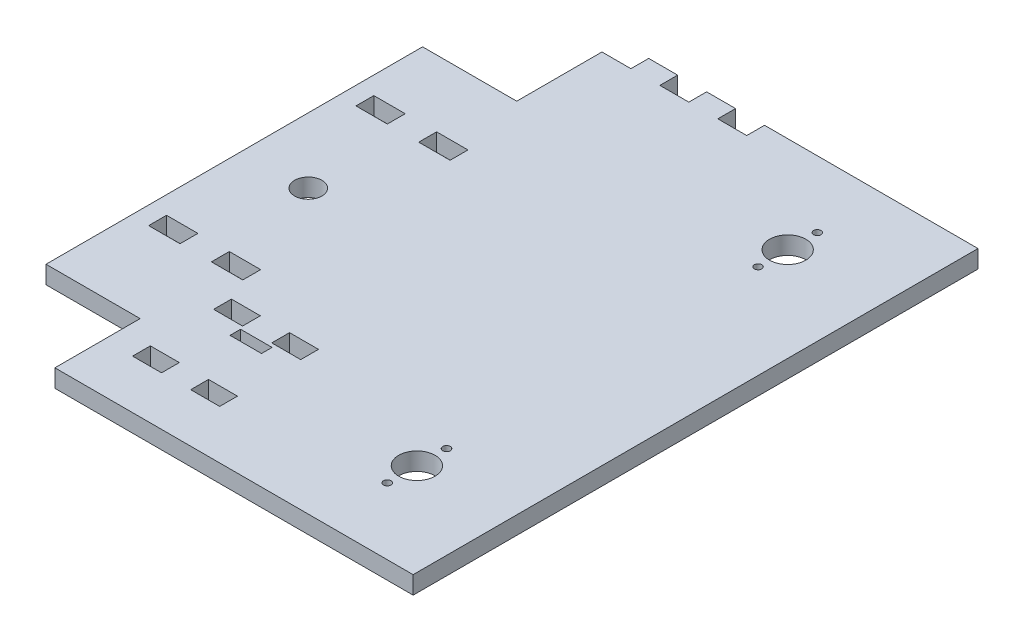
from build123d import *

# Parameters (mm, degrees)
SKETCH1_W           = 96.655493252
SKETCH1_H           = 152.4
BOSS_EXTRUDE1_DEPTH = 4.800000052
SKETCH3_W           = 7.8117192
SKETCH3_H           = 4.800000052
CUT_EXTRUDE2_DEPTH  = 181.530009628
SKETCH5_W           = 8.5
SKETCH5_H           = 2.852224977
CUT_EXTRUDE3_DEPTH  = 181.530009628
SKETCH6_W           = 101.6
SKETCH6_H           = 4.800000052
BOSS_EXTRUDE2_DEPTH = 25.4
SKETCH7_R           = 3.683
CUT_EXTRUDE4_DEPTH  = 181.530009628
SKETCH8_W           = 8.466666666
SKETCH8_H           = 4.826
SKETCH8_W_2         = 8.466666667
CUT_EXTRUDE5_DEPTH  = 181.530009628
SKETCH9_R           = 1.00000054
SKETCH9_R_2         = 1
SKETCH9_R_3         = 1.016
SKETCH9_R_4         = 4.899999979
CUT_EXTRUDE6_DEPTH  = 181.530009628


with BuildPart() as part:
    # Sketch1 → Boss-Extrude1 (new body)
    with BuildSketch(Plane(origin=(0, 0, 0), x_dir=(1, 0, 0), z_dir=(0, 1, 0))):
        with Locations((48.327746626, 76.2)):
            Rectangle(SKETCH1_W, SKETCH1_H)
    extrude(amount=BOSS_EXTRUDE1_DEPTH)

    # Sketch3 → Cut-Extrude2 (cut, through all)
    with BuildSketch(Plane.XZ):
        with Locations((3.9058596, -149.999999974)):
            Rectangle(SKETCH3_W, SKETCH3_H)
        with Locations((19.529298, -149.999999974)):
            Rectangle(SKETCH3_W, SKETCH3_H)
        with Locations((35.1527364, -149.999999974)):
            Rectangle(SKETCH3_W, SKETCH3_H)
        with Locations((27.3410172, -37.473737167)):
            Rectangle(SKETCH3_W, SKETCH3_H)
        with Locations((11.655298, -37.473737167)):
            Rectangle(SKETCH3_W, SKETCH3_H)
        with Locations((11.655298, -15.608000026)):
            Rectangle(SKETCH3_W, SKETCH3_H)
        with Locations((27.3410172, -15.608000026)):
            Rectangle(SKETCH3_W, SKETCH3_H)
    extrude(amount=-CUT_EXTRUDE2_DEPTH, mode=Mode.SUBTRACT)

    # Sketch5 → Cut-Extrude3 (cut, through all)
    with BuildSketch(Plane(origin=(0, 0, 0), x_dir=(-1, 0, 0), z_dir=(0, -1, 0))):
        with Locations((-20.288559041, 32.636660711)):
            Rectangle(SKETCH5_W, SKETCH5_H)
    extrude(amount=-CUT_EXTRUDE3_DEPTH, mode=Mode.SUBTRACT)

    # Sketch6 → Boss-Extrude2 (add)
    with BuildSketch(Plane.ZY):
        with Locations((-73.799999974, 2.400000026)):
            Rectangle(SKETCH6_W, SKETCH6_H)
    extrude(amount=BOSS_EXTRUDE2_DEPTH)

    # Sketch7 → Cut-Extrude4 (cut, through all)
    with BuildSketch(Plane(origin=(0, 4.800000052, 0), x_dir=(1, 0, 0), z_dir=(0, 1, 0))):
        with Locations(Location((-7.800402362, 76.161515735, 0), (0, 0, 270))):
            Circle(SKETCH7_R)
    extrude(amount=-CUT_EXTRUDE4_DEPTH, mode=Mode.SUBTRACT)

    # Sketch8 → Cut-Extrude5 (cut, through all)
    with BuildSketch(Plane(origin=(0, 4.800000052, 0), x_dir=(1, 0, 0), z_dir=(0, 1, 0))):
        with Locations((-16.346648987, 48.284809597)):
            Rectangle(SKETCH8_W, SKETCH8_H)
        with Locations((0.586684347, 48.284809597)):
            Rectangle(SKETCH8_W_2, SKETCH8_H)
        with Locations((-16.346648987, 104.21722165)):
            Rectangle(SKETCH8_W, SKETCH8_H)
        with Locations((0.586684347, 104.21722165)):
            Rectangle(SKETCH8_W_2, SKETCH8_H)
    extrude(amount=-CUT_EXTRUDE5_DEPTH, mode=Mode.SUBTRACT)

    # Sketch9 → Cut-Extrude6 (cut, through all)
    with BuildSketch(Plane(origin=(0, 4.800000052, 0), x_dir=(1, 0, 0), z_dir=(0, 1, 0))):
        with Locations(Location((71.255493252, 118.448957867, 0), (0, 0, 270))):
            Circle(SKETCH9_R)
        with Locations(Location((71.255493252, 134.448957871, 0), (0, 0, 270))):
            Circle(SKETCH9_R_2)
        with Locations(Location((71.713159771, 33.950000045, 0), (0, 0, 270))):
            Circle(SKETCH9_R_3)
        with Locations(Location((71.713159771, 17.950000041, 0), (0, 0, 270))):
            Circle(SKETCH9_R_3)
        with Locations(Location((71.713159771, 25.950000043, 0), (0, 0, 270))):
            Circle(SKETCH9_R_4)
        with Locations(Location((71.255493252, 126.448957869, 0), (0, 0, 270))):
            Circle(SKETCH9_R_4)
    extrude(amount=-CUT_EXTRUDE6_DEPTH, mode=Mode.SUBTRACT)


solid = part.part
